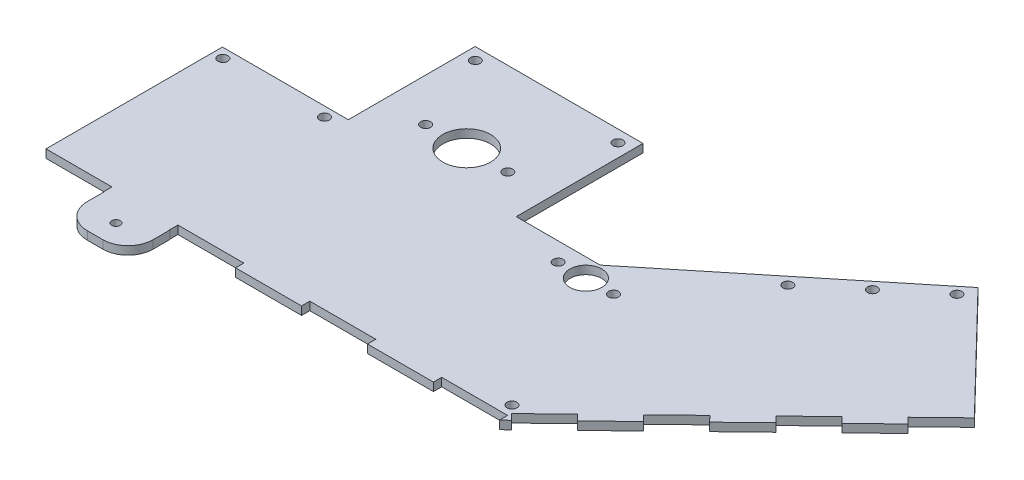
from build123d import *

# Parameters (mm, degrees)
SKETCH1_R           = 1.27
BOSS_EXTRUDE1_DEPTH = 2.5
SKETCH2_W           = 19.957142857
SKETCH2_H           = 2.5
CUT_EXTRUDE1_DEPTH  = 2.5
CUT_EXTRUDE2_DEPTH  = 2.5
SKETCH4_R           = 1.5
CUT_EXTRUDE3_DEPTH  = 2.5
SKETCH5_R           = 7.239
SKETCH5_R_2         = 1.5
CUT_EXTRUDE4_DEPTH  = 2.5
SKETCH6_R           = 4.83219682
SKETCH6_R_2         = 1.5
CUT_EXTRUDE5_DEPTH  = 2.5
SKETCH7_R           = 1.5
CUT_EXTRUDE6_DEPTH  = 2.54
FILLET1_R           = 7.62


with BuildPart() as part:
    # Sketch1 → Boss-Extrude1 (new body)
    with BuildSketch(Plane(origin=(0, 0, 0), x_dir=(1, 0, 0), z_dir=(0, 1, 0))):
        Polygon((0, 0), (-38.1, 0), (-38.1, -55.88), (-18.034, -55.88), (-18.034, -68.58), (1.905, -68.58), (1.905, -55.88), (101.6, -55.88), (174.591014612, 14.794406866), (139.253811179, 51.289914172), (76.2, 0), (50.8, 0), (50.8, 38.374100719), (0, 38.374100719), align=None)
        with Locations(Location((-8.0645, -62.23, 0), (0, 0, 270))):
            Circle(SKETCH1_R, mode=Mode.SUBTRACT)
    extrude(amount=BOSS_EXTRUDE1_DEPTH)

    # Sketch2 → Cut-Extrude1 (cut)
    with BuildSketch(Plane(origin=(0, 2.5, 0), x_dir=(1, 0, 0), z_dir=(0, 1, 0))):
        with Locations((-28.121428572, -54.63)):
            Rectangle(SKETCH2_W, SKETCH2_H)
        with Locations((11.792857143, -54.63)):
            Rectangle(SKETCH2_W, SKETCH2_H)
        with Locations((51.707142858, -54.63)):
            Rectangle(SKETCH2_W, SKETCH2_H)
        with Locations((91.621428572, -54.63)):
            Rectangle(SKETCH2_W, SKETCH2_H)
    extrude(amount=-CUT_EXTRUDE1_DEPTH, mode=Mode.SUBTRACT)

    # Sketch3 → Cut-Extrude2 (cut)
    with BuildSketch(Plane(origin=(0, 2.5, 0), x_dir=(1, 0, 0), z_dir=(0, 1, 0))):
        Polygon((101.685739763, -52.317101083), (103.424775365, -54.113139828), (113.591380972, -44.269204586), (111.85234537, -42.473165841), align=None)
        Polygon((122.018950977, -32.629230599), (123.757986579, -34.425269344), (133.924592185, -24.581334102), (132.185556583, -22.785295357), align=None)
        Polygon((142.35216219, -12.941360115), (144.091197792, -14.73739886), (154.257803399, -4.893463618), (152.518767797, -3.097424873), align=None)
        Polygon((162.685373403, 6.74651037), (164.424409005, 4.950471624), (174.591014612, 14.794406866), (172.85197901, 16.590445612), align=None)
    extrude(amount=-CUT_EXTRUDE2_DEPTH, mode=Mode.SUBTRACT)

    # Sketch4 → Cut-Extrude3 (cut)
    with BuildSketch(Plane(origin=(0, 2.5, 0), x_dir=(1, 0, 0), z_dir=(0, 1, 0))):
        with Locations(Location((-4.285702379, -2.932700938, 0), (0, 0, 270))):
            Circle(SKETCH4_R)
        with Locations(Location((-35.019835528, -2.932700938, 0), (0, 0, 270))):
            Circle(SKETCH4_R)
        with Locations(Location((3.703940689, 34.739752907, 0), (0, 0, 270))):
            Circle(SKETCH4_R)
        with Locations(Location((46.856938601, 34.739752907, 0), (0, 0, 270))):
            Circle(SKETCH4_R)
        with Locations(Location((137.828101929, 46.33680801, 0), (0, 0, 270))):
            Circle(SKETCH4_R)
        with Locations(Location((109.860015666, 23.133232504, 0), (0, 0, 270))):
            Circle(SKETCH4_R)
        with Locations(Location((123.849763227, 34.739752907, 0), (0, 0, 270))):
            Circle(SKETCH4_R)
    extrude(amount=-CUT_EXTRUDE3_DEPTH, mode=Mode.SUBTRACT)

    # Sketch5 → Cut-Extrude4 (cut)
    with BuildSketch(Plane(origin=(0, 2.5, 0), x_dir=(1, 0, 0), z_dir=(0, 1, 0))):
        with Locations(Location((25.4, 10.434100719, 0), (0, 0, 270))):
            Circle(SKETCH5_R)
        with Locations(Location((12.954, 10.434100719, 0), (0, 0, 270))):
            Circle(SKETCH5_R_2)
        with Locations(Location((37.846, 10.434100719, 0), (0, 0, 270))):
            Circle(SKETCH5_R_2)
    extrude(amount=-CUT_EXTRUDE4_DEPTH, mode=Mode.SUBTRACT)

    # Sketch6 → Cut-Extrude5 (cut)
    with BuildSketch(Plane(origin=(0, 2.5, 0), x_dir=(1, 0, 0), z_dir=(0, 1, 0))):
        with Locations(Location((77.47, -5.588, 0), (0, 0, 270))):
            Circle(SKETCH6_R)
        with Locations(Location((69.088, -5.588, 0), (0, 0, 270))):
            Circle(SKETCH6_R_2)
        with Locations(Location((85.852, -5.588, 0), (0, 0, 270))):
            Circle(SKETCH6_R_2)
    extrude(amount=-CUT_EXTRUDE5_DEPTH, mode=Mode.SUBTRACT)

    # Sketch7 → Cut-Extrude6 (cut)
    with BuildSketch(Plane(origin=(0, 2.5, 0), x_dir=(1, 0, 0), z_dir=(0, 1, 0))):
        with Locations(Location((99.525450368, -50.013841017, 0), (0, 0, 270))):
            Circle(SKETCH7_R)
    extrude(amount=-CUT_EXTRUDE6_DEPTH, mode=Mode.SUBTRACT)

    # Fillet1
    fillet1_edges = [part.edges().sort_by_distance(p)[0] for p in [
        (1.905, 1.25, 68.58),
        (-18.034, 1.25, 68.58),
    ]]
    fillet(fillet1_edges, radius=FILLET1_R)


solid = part.part
